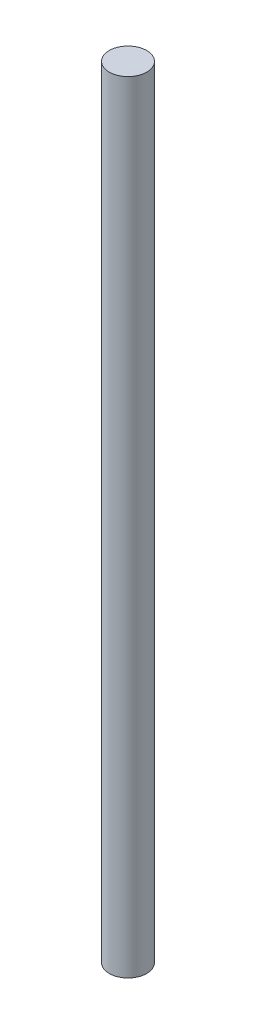
from build123d import *

# Parameters (mm, degrees)
SKETCH1_R           = 3
BOSS_EXTRUDE1_DEPTH = 125


with BuildPart() as part:
    # Sketch1 → Boss-Extrude1 (new body)
    with BuildSketch(Plane(origin=(0, 0, 0), x_dir=(1, 0, 0), z_dir=(0, 1, 0))):
        with Locations(Location((0, 0, 0), (0, 0, 270))):
            Circle(SKETCH1_R)
    extrude(amount=BOSS_EXTRUDE1_DEPTH)


solid = part.part
